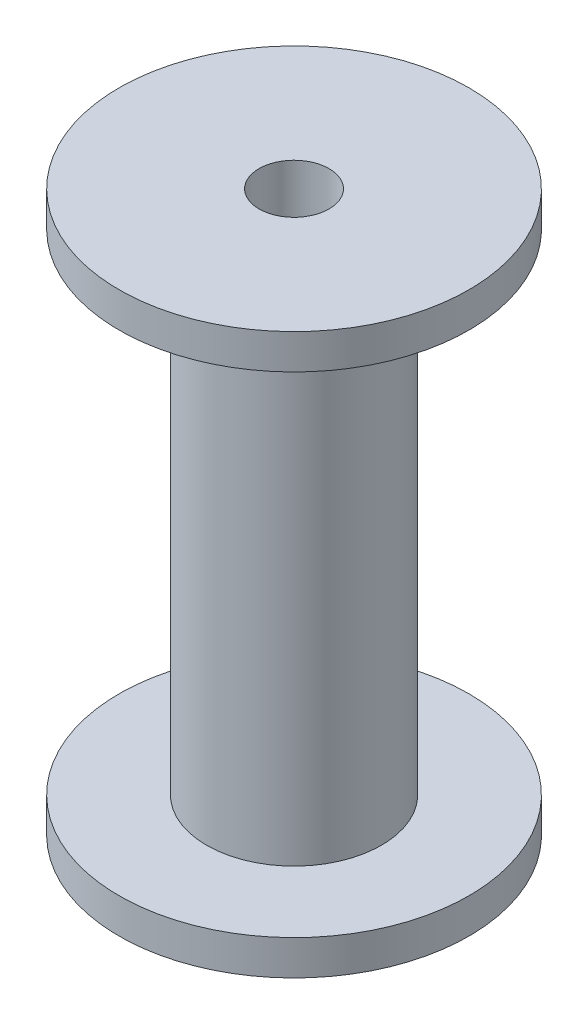
from build123d import *

# Parameters (mm, degrees)
SKETCH3_R          = 12.7
CUT_EXTRUDE1_DEPTH = 223.159267194


with BuildPart() as part:
    # Sketch2 → Revolve1 (revolve)
    with BuildSketch(Plane.XY, mode=Mode.PRIVATE) as revolve1_sk:
        Polygon((0, 0), (0, 203.2), (63.5, 203.2), (63.5, 190.5), (31.75, 190.5), (31.75, 12.7), (63.5, 12.7), (63.5, 0), align=None)
    revolve(revolve1_sk.sketch.rotate(Axis((0, 0, 0), (0, 1, 0)), 90), axis=Axis((0, 0, 0), (0, 1, 0)))

    # Sketch3 → Cut-Extrude1 (cut, through all)
    with BuildSketch(Plane(origin=(0, 203.2, 0), x_dir=(1, 0, 0), z_dir=(0, 1, 0))):
        with Locations(Location((0, 0, 0), (0, 0, 270))):
            Circle(SKETCH3_R)
    extrude(amount=-CUT_EXTRUDE1_DEPTH, mode=Mode.SUBTRACT)


solid = part.part
